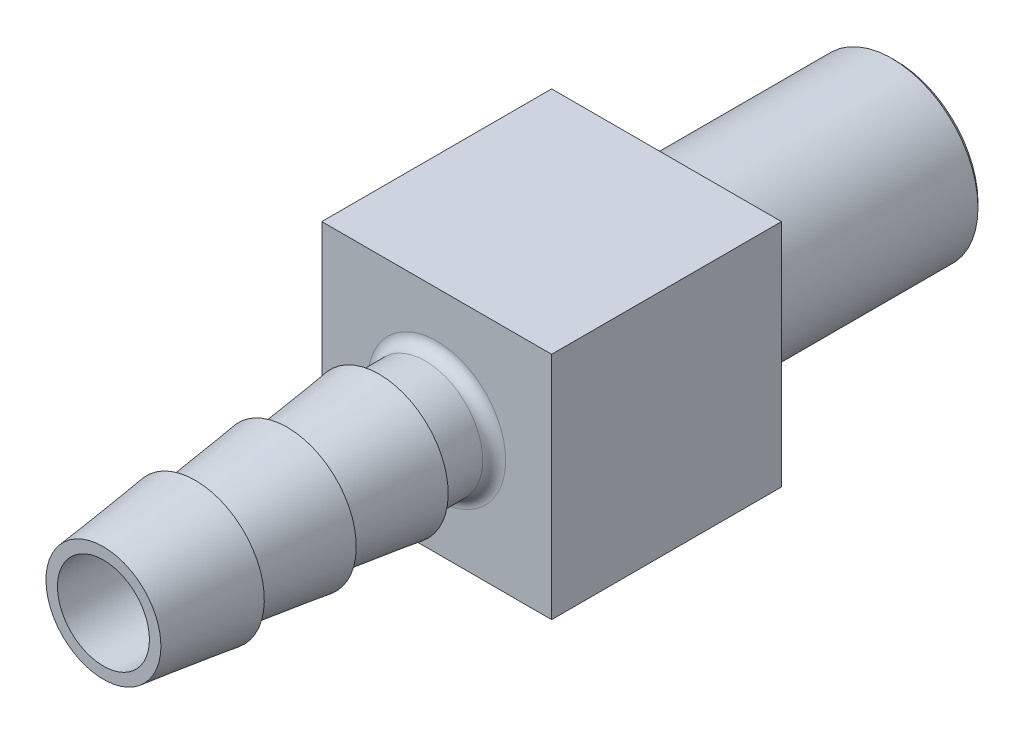
from build123d import *

# Parameters (mm, degrees)
SKETCH1_R           = 4.7625
BOSS_EXTRUDE1_DEPTH = 12.7
CHAMFER1_SIZE       = 0.254
SKETCH2_W           = 12.7
SKETCH2_H           = 12.7
BOSS_EXTRUDE2_DEPTH = 12.7
FILLET1_R           = 0.635
CUT_EXTRUDE2_START  = -20.32
SKETCH5_R           = 3.175
CUT_EXTRUDE2_DEPTH  = 20.32
SKETCH6_R           = 2.54
CUT_EXTRUDE3_DEPTH  = 23.876


with BuildPart() as part:
    # Sketch1 → Boss-Extrude1 (new body)
    with BuildSketch(Plane.XY):
        Circle(SKETCH1_R)
    extrude(amount=BOSS_EXTRUDE1_DEPTH)

    # Chamfer1
    chamfer1_edges = [part.edges().sort_by_distance(p)[0] for p in [
        (-4.7625, 0, 0),
    ]]
    chamfer(chamfer1_edges, length=CHAMFER1_SIZE)

    # Sketch2 → Boss-Extrude2 (add)
    with BuildSketch(Plane.XY.offset(12.7)):
        Rectangle(SKETCH2_W, SKETCH2_H)
    extrude(amount=BOSS_EXTRUDE2_DEPTH)

    # Sketch3 → Revolve1 (revolve)
    with BuildSketch(Plane(origin=(0, 0, 0), x_dir=(0, 0, -1), z_dir=(1, 0, 0))):
        Polygon((-25.4, 3.175), (-28.575, 3.175), (-28.575, 3.81), (-33.655, 3.175), (-33.655, 3.81), (-38.735, 3.175), (-38.735, 3.81), (-43.815, 3.175), (-43.815, 0), (-25.4, 0), align=None)
    revolve(axis=Axis((0, 0, 19.05), (0, 0, 1)))

    # Fillet1
    fillet1_edges = [part.edges().sort_by_distance(p)[0] for p in [
        (0, -3.175, 25.4),
        (-4.7625, 0, 12.7),
    ]]
    fillet(fillet1_edges, radius=FILLET1_R)

    # Sketch5 → Cut-Extrude2 (cut)
    with BuildSketch(Plane(origin=(0, 0, 0), x_dir=(-1, 0, 0), z_dir=(0, 0, -1)).offset(CUT_EXTRUDE2_START)):
        with Locations(Location((0, 0, 0), (0, 0, 90))):
            Circle(SKETCH5_R)
    extrude(amount=CUT_EXTRUDE2_DEPTH, mode=Mode.SUBTRACT)

    # Sketch6 → Cut-Extrude3 (cut)
    with BuildSketch(Plane.XY.offset(43.815)):
        Circle(SKETCH6_R)
    extrude(amount=-CUT_EXTRUDE3_DEPTH, mode=Mode.SUBTRACT)


solid = part.part
